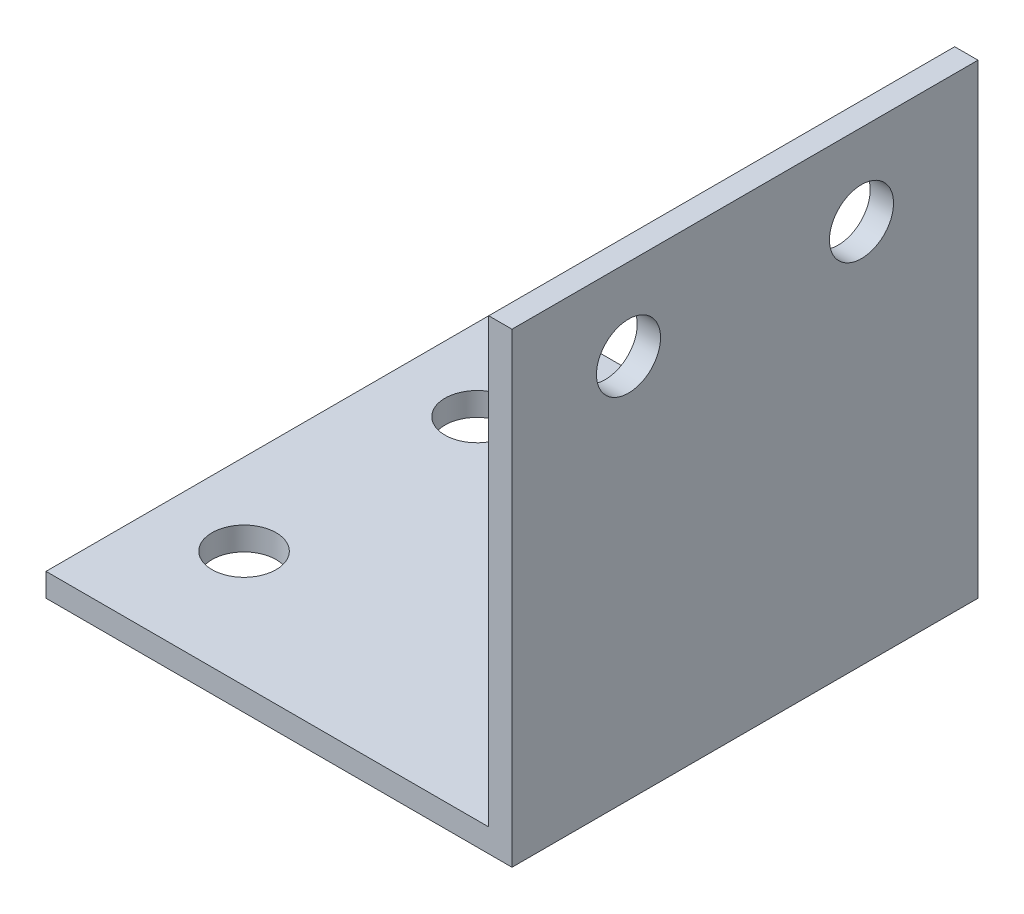
from build123d import *

# Parameters (mm, degrees)
EXTRUDE_1_DEPTH     = 40
SKETCH_2_R          = 2.75
CUT_EXTRUDE_1_DEPTH = 40


with BuildPart() as part:
    # 草图1 → 凸台-拉伸1 (new body)
    with BuildSketch(Plane.XY):
        Polygon((0, 0), (0, -2), (40, -2), (40, 38), (38, 38), (38, 0), align=None)
    extrude(amount=EXTRUDE_1_DEPTH)

    # 草图2 → 切除-拉伸1 (cut)
    with BuildSketch(Plane(origin=(40, 0, 0), x_dir=(0, 0, -1), z_dir=(1, 0, 0))):
        with Locations((-30, 31)):
            Circle(SKETCH_2_R)
        with Locations(Location((-10, 31, 0), (0, 0, 90))):
            Circle(SKETCH_2_R)
    cut_extrude_1 = extrude(amount=-CUT_EXTRUDE_1_DEPTH, mode=Mode.SUBTRACT)

    # 镜向1: 切除-拉伸1 across plane
    add(cut_extrude_1.mirror(Plane(origin=(19, 19, 0), x_dir=(0, 0, 1), z_dir=(0.7071067811865488, 0.7071067811865464, 0))), mode=Mode.SUBTRACT)


solid = part.part
